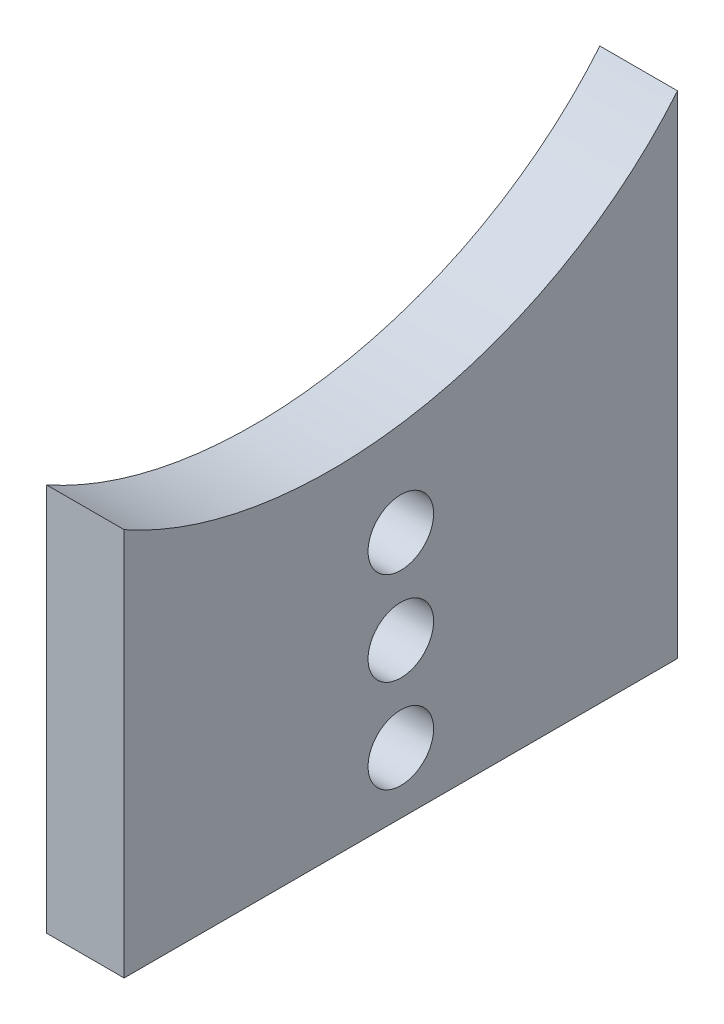
from build123d import *

# Parameters (mm, degrees)
SKETCH1_R           = 4.221837906
BOSS_EXTRUDE1_DEPTH = 10


with BuildPart() as part:
    # Sketch1 → Boss-Extrude1 (new body)
    with BuildSketch(Plane(origin=(0, 0, 0), x_dir=(0, 0, -1), z_dir=(1, 0, 0))):
        with BuildLine():
            Line((-29.05259943, -0.165516433), (-29.05259943, -50.165516433))
            Line((-29.05259943, -50.165516433), (42.210436172, -50.165516433))
            Line((42.210436172, -50.165516433), (42.210436172, 13.142555632))
            add(Edge.make_bspline(
                [(-29.05259943, -0.165516433), (-6.499992704, -12.774809737), (25.427672134, -7.094962856), (42.210436172, 13.142555632)],
                knots=[0, 0, 0, 0, 1, 1, 1, 1], degree=3))
        make_face()
        with Locations((6.578918371, -42.29705463)):
            Circle(SKETCH1_R, mode=Mode.SUBTRACT)
        with Locations((6.578918371, -30.29705463)):
            Circle(SKETCH1_R, mode=Mode.SUBTRACT)
        with Locations((6.578918371, -18.29705463)):
            Circle(SKETCH1_R, mode=Mode.SUBTRACT)
    extrude(amount=BOSS_EXTRUDE1_DEPTH)


solid = part.part
